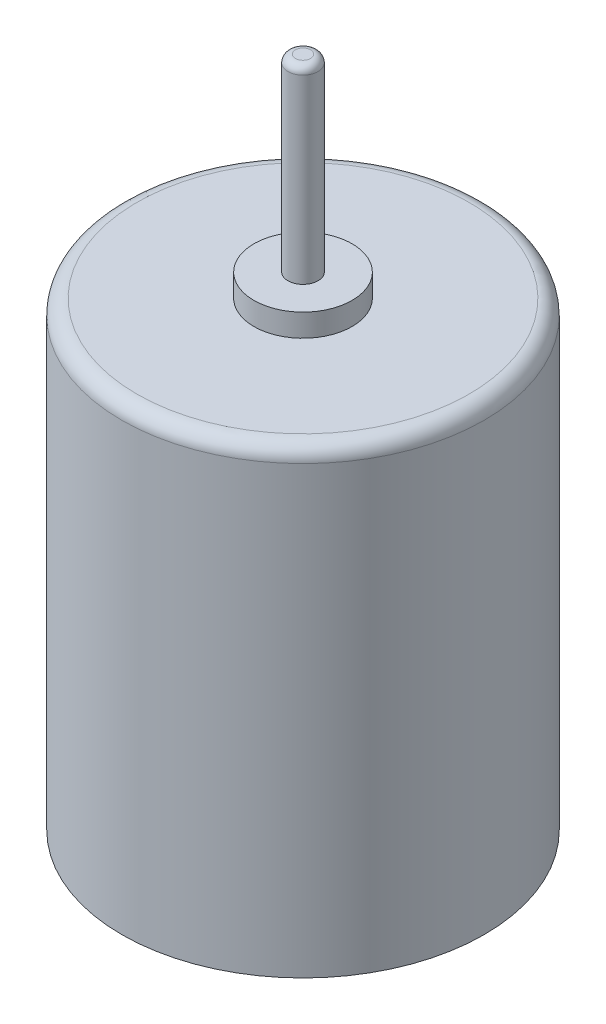
from build123d import *

# Parameters (mm, degrees)
SKETCH1_R           = 12
BOSS_EXTRUDE1_DEPTH = 30.5
SKETCH1_3_R         = 3.25
SKETCH1_3_R_2       = 1
BOSS_EXTRUDE2_DEPTH = 32
SKETCH1_4_R         = 1
BOSS_EXTRUDE3_DEPTH = 44.5
FILLET1_R           = 0.5
FILLET2_R           = 1


with BuildPart() as part:
    # Sketch1 → Boss-Extrude1 (new body)
    with BuildSketch(Plane(origin=(0, 0, 0), x_dir=(1, 0, 0), z_dir=(0, 1, 0))):
        with Locations((-13.105100699, 2.502858666)):
            Circle(SKETCH1_R)
    extrude(amount=BOSS_EXTRUDE1_DEPTH)

    # Sketch1<3> → Boss-Extrude2 (add)
    with BuildSketch(Plane(origin=(0, 0, 0), x_dir=(1, 0, 0), z_dir=(0, 1, 0))):
        with Locations((-13.105100699, 2.502858666)):
            Circle(SKETCH1_3_R)
        with Locations((-13.105100699, 2.502858666)):
            Circle(SKETCH1_3_R_2, mode=Mode.SUBTRACT)
    extrude(amount=BOSS_EXTRUDE2_DEPTH)

    # Sketch1<4> → Boss-Extrude3 (add)
    with BuildSketch(Plane(origin=(0, 0, 0), x_dir=(1, 0, 0), z_dir=(0, 1, 0))):
        with Locations((-13.105100699, 2.502858666)):
            Circle(SKETCH1_4_R)
    extrude(amount=BOSS_EXTRUDE3_DEPTH)

    # Fillet1
    fillet1_edges = [part.edges().sort_by_distance(p)[0] for p in [
        (-14.105100699, 44.5, -2.502858666),
    ]]
    fillet(fillet1_edges, radius=FILLET1_R)

    # Fillet2
    fillet2_edges = [part.edges().sort_by_distance(p)[0] for p in [
        (-25.105100699, 30.5, -2.502858666),
    ]]
    fillet(fillet2_edges, radius=FILLET2_R)


solid = part.part
